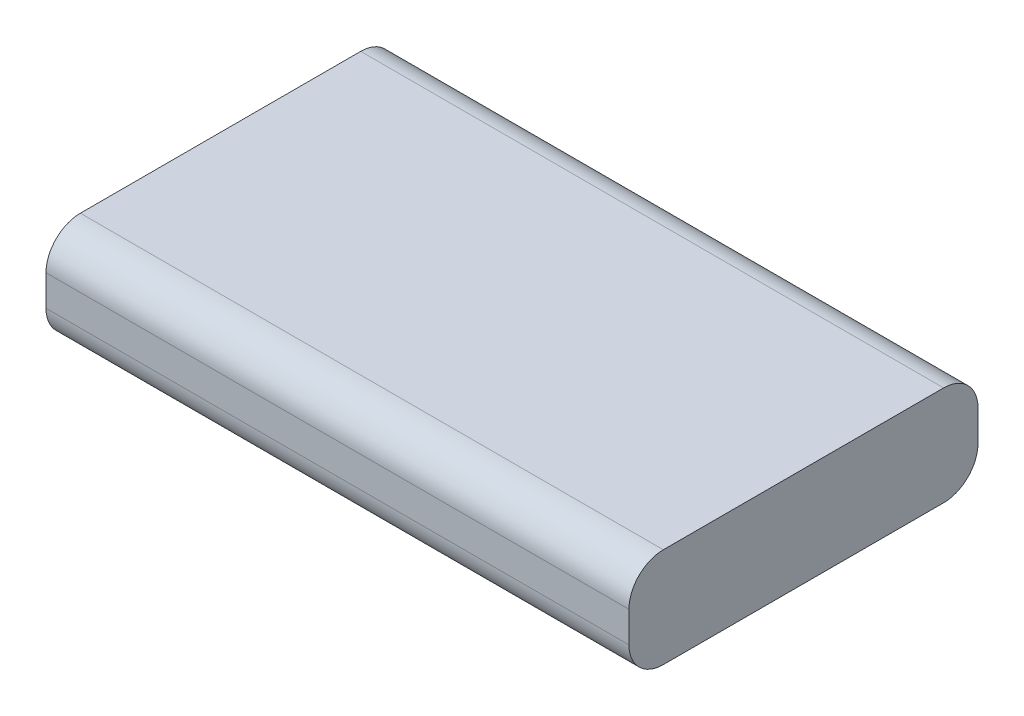
from build123d import *

# Parameters (mm, degrees)
SKETCH1_W           = 84.84
SKETCH1_H           = 50.8
BOSS_EXTRUDE1_DEPTH = 14.48
FILLET1_R           = 5


with BuildPart() as part:
    # Sketch1 → Boss-Extrude1 (new body)
    with BuildSketch(Plane(origin=(0, 0, 0), x_dir=(1, 0, 0), z_dir=(0, 1, 0))):
        with Locations((42.42, 25.4)):
            Rectangle(SKETCH1_W, SKETCH1_H)
    extrude(amount=BOSS_EXTRUDE1_DEPTH)

    # Fillet1
    fillet1_edges = [part.edges().sort_by_distance(p)[0] for p in [
        (42.42, 14.48, -50.8),
        (42.42, 0, -50.8),
        (42.42, 0, 0),
        (42.42, 14.48, 0),
    ]]
    fillet(fillet1_edges, radius=FILLET1_R)


solid = part.part
